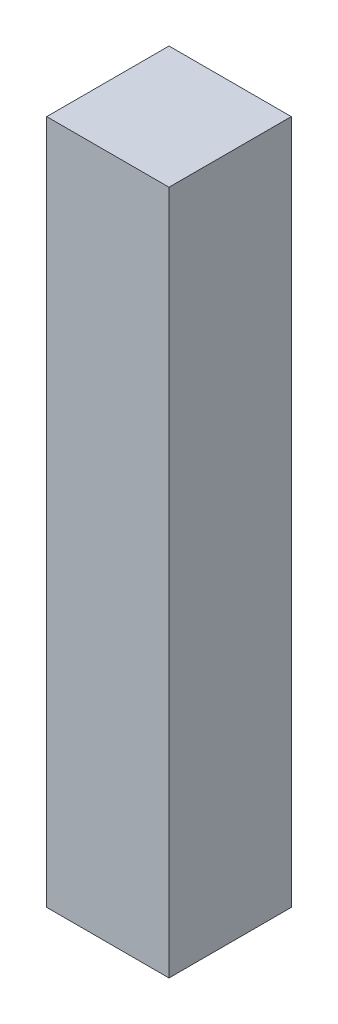
from build123d import *

# Parameters (mm, degrees)
SKETCH_1_W             = 5
SKETCH_1_H             = 28
GUIDE_SIDE_BRACE_DEPTH = 5


with BuildPart() as part:
    # 草图1 → Guide_side_brace (new body)
    with BuildSketch(Plane.XY):
        with Locations((2.5, 14)):
            Rectangle(SKETCH_1_W, SKETCH_1_H)
    extrude(amount=GUIDE_SIDE_BRACE_DEPTH)


solid = part.part
